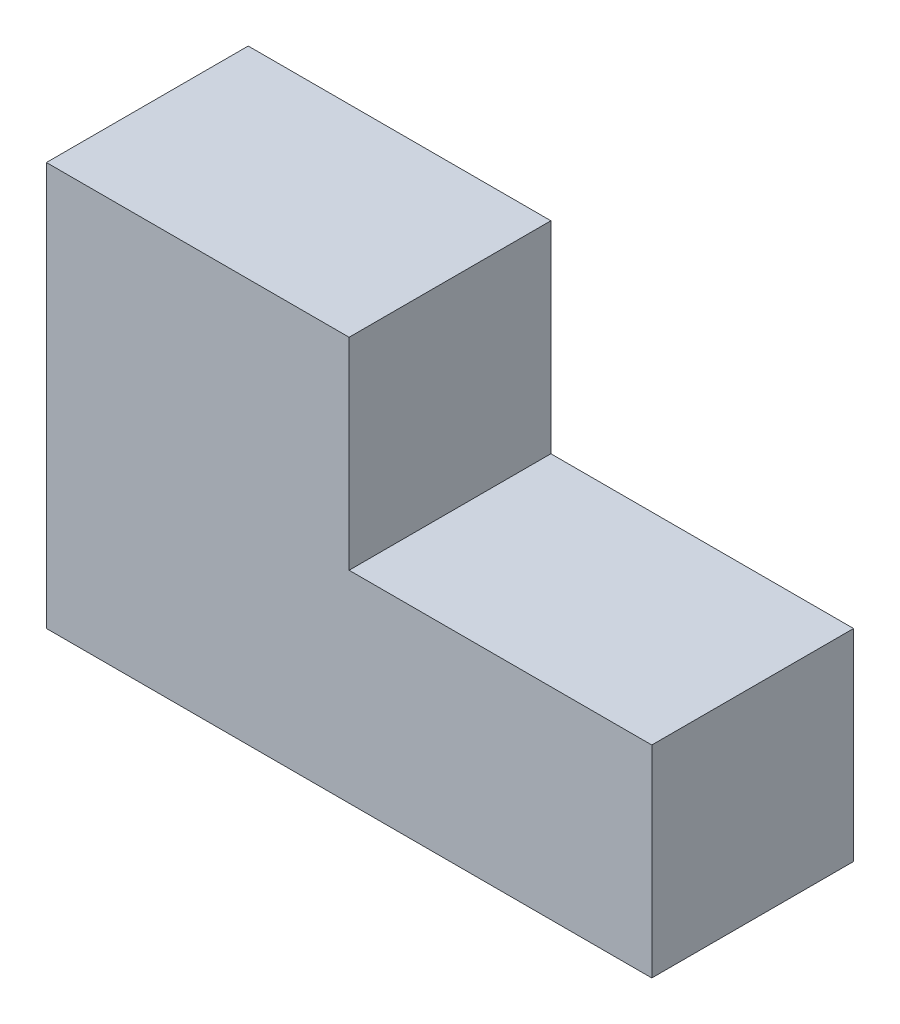
from build123d import *

# Parameters (mm, degrees)
EXTRUDE_1_DEPTH = 20


with BuildPart() as part:
    # 草图1 → 凸台-拉伸1 (new body)
    with BuildSketch(Plane.XY):
        Polygon((0, 0), (60, 0), (60, 20), (30, 20), (30, 40), (0, 40), align=None)
    extrude(amount=EXTRUDE_1_DEPTH)


solid = part.part
